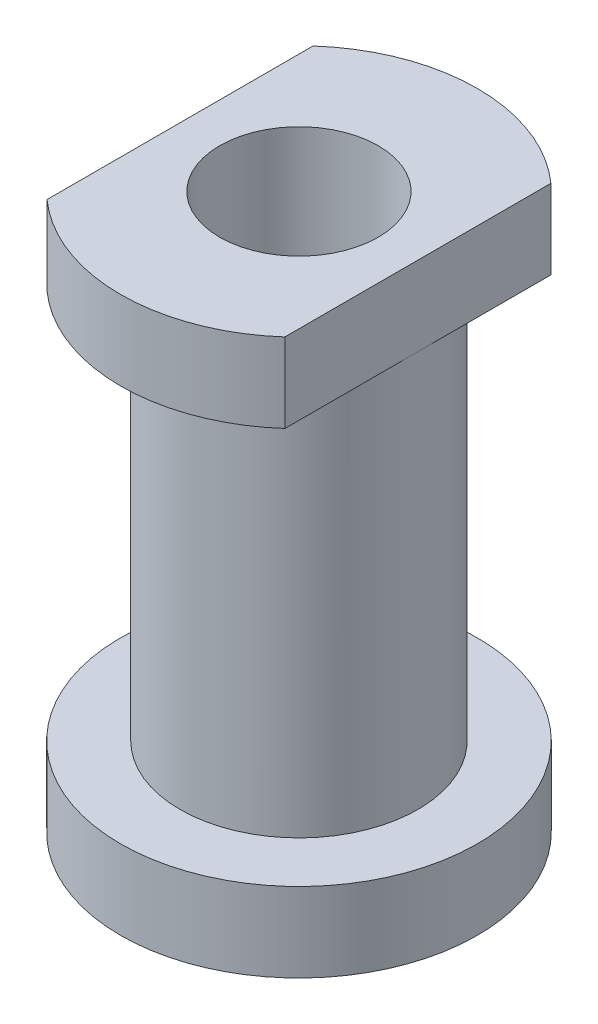
from build123d import *

# Parameters (mm, degrees)
SKETCH1_R           = 22.5
SKETCH1_R_2         = 15
BOSS_EXTRUDE1_DEPTH = 10
SKETCH1_3_R         = 10
BOSS_EXTRUDE2_DEPTH = 70
BOSS_EXTRUDE3_START = 60
BOSS_EXTRUDE3_DEPTH = 10


with BuildPart() as part:
    # Sketch1 → Boss-Extrude1 (new body)
    with BuildSketch(Plane(origin=(0, 0, 0), x_dir=(1, 0, 0), z_dir=(0, 1, 0))):
        Circle(SKETCH1_R)
        Circle(SKETCH1_R_2, mode=Mode.SUBTRACT)
    extrude(amount=BOSS_EXTRUDE1_DEPTH)

    # Sketch1<3> → Boss-Extrude2 (add)
    with BuildSketch(Plane(origin=(0, 0, 0), x_dir=(1, 0, 0), z_dir=(0, 1, 0))):
        with BuildLine():
            ThreePointArc((-15, 1.4e-08), (-7e-09, -15), (15, 0))
            ThreePointArc((15, 0), (7e-09, 15), (-15, 1.4e-08))
        make_face()
        Circle(SKETCH1_3_R, mode=Mode.SUBTRACT)
    extrude(amount=BOSS_EXTRUDE2_DEPTH)

    # Sketch1<4> → Boss-Extrude3 (add)
    with BuildSketch(Plane(origin=(0, 0, 0), x_dir=(1, 0, 0), z_dir=(0, 1, 0)).offset(BOSS_EXTRUDE3_START)):
        with BuildLine():
            ThreePointArc((-15, -16.770509831), (0, -22.5), (15, -16.770509831))
            Line((15, -16.770509831), (15, 0))
            ThreePointArc((15, 0), (-7e-09, -15), (-15, 1.4e-08))
            Line((-15, 1.4e-08), (-15, -16.770509831))
        make_face()
        with BuildLine():
            ThreePointArc((-15, 1.4e-08), (7e-09, 15), (15, 0))
            Line((15, 0), (15, 16.770509831))
            ThreePointArc((15, 16.770509831), (0, 22.5), (-15, 16.770509831))
            Line((-15, 16.770509831), (-15, 1.4e-08))
        make_face()
    extrude(amount=BOSS_EXTRUDE3_DEPTH)


solid = part.part
